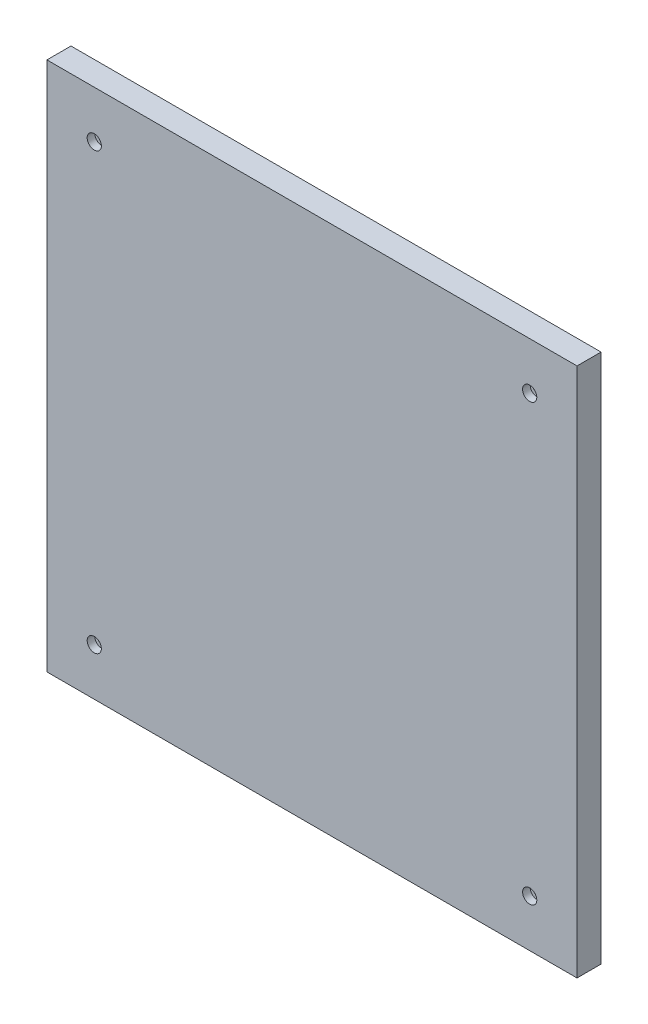
from build123d import *

# Parameters (mm, degrees)
SKETCH1_W           = 280
SKETCH1_H           = 280
SKETCH1_R           = 2
BOSS_EXTRUDE1_DEPTH = 12.7
SKETCH2_R           = 3.75
CUT_EXTRUDE1_DEPTH  = 4


with BuildPart() as part:
    # Sketch1 → Boss-Extrude1 (new body)
    with BuildSketch(Plane.XY):
        with Locations((324.065660481, 102.017007569)):
            Rectangle(SKETCH1_W, SKETCH1_H)
        with Locations((209.065660481, 217.017007569)):
            Circle(SKETCH1_R, mode=Mode.SUBTRACT)
        with Locations((439.065660481, 217.017007569)):
            Circle(SKETCH1_R, mode=Mode.SUBTRACT)
        with Locations((439.065660481, -12.982992431)):
            Circle(SKETCH1_R, mode=Mode.SUBTRACT)
        with Locations((209.065660481, -12.982992431)):
            Circle(SKETCH1_R, mode=Mode.SUBTRACT)
    extrude(amount=BOSS_EXTRUDE1_DEPTH)

    # Sketch2 → Cut-Extrude1 (cut)
    with BuildSketch(Plane.XY.offset(12.7)):
        with Locations((209.065660481, -12.982992431)):
            Circle(SKETCH2_R)
        with Locations((209.065660481, 217.017007569)):
            Circle(SKETCH2_R)
        with Locations((439.065660481, 217.017007569)):
            Circle(SKETCH2_R)
        with Locations((439.065660481, -12.982992431)):
            Circle(SKETCH2_R)
    extrude(amount=-CUT_EXTRUDE1_DEPTH, mode=Mode.SUBTRACT)


solid = part.part
